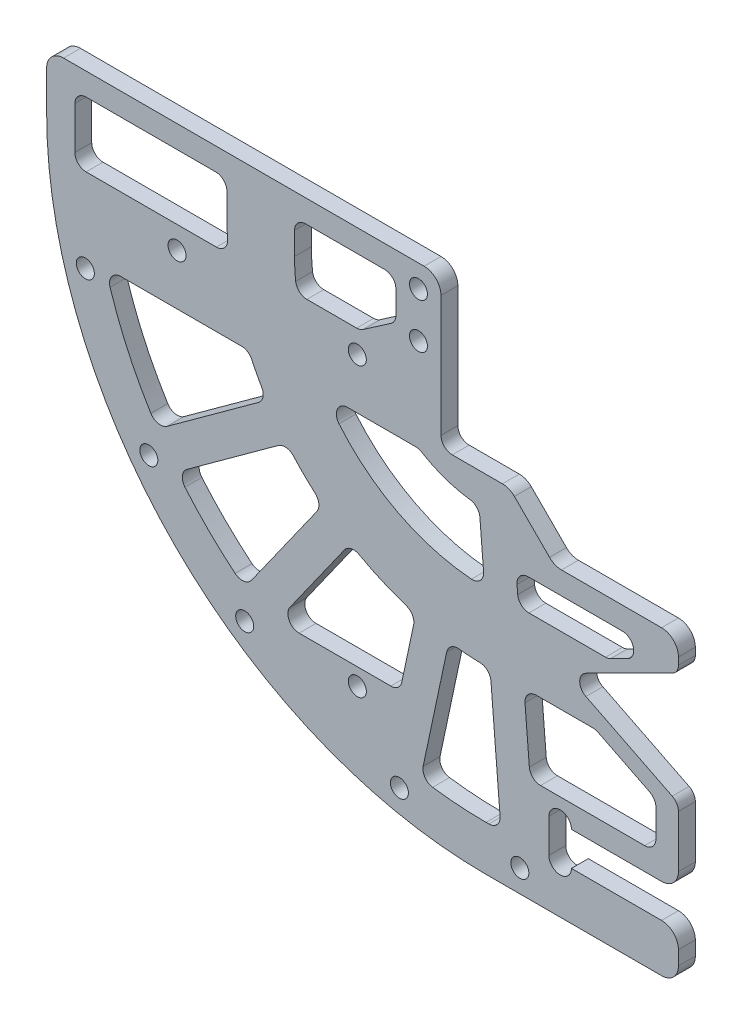
from build123d import *

# Parameters (mm, degrees)
EXTRUDE_1_DEPTH     = 3
SKETCH_3_R          = 1.6
CUT_EXTRUDE_1_DEPTH = 10
SKETCH_4_R          = 1.6
CUT_EXTRUDE_2_DEPTH = 10
SKETCH_5_R          = 2
CUT_EXTRUDE_3_DEPTH = 10
SKETCH_6_R          = 1.6
CUT_EXTRUDE_4_DEPTH = 3
SKETCH_7_R          = 1.6
CUT_EXTRUDE_5_DEPTH = 3
FILLET_1_R          = 2
CUT_EXTRUDE_6_DEPTH = 11.6
FILLET_2_R          = 3
CUT_EXTRUDE_7_DEPTH = 11.6
EXTRUDE_2_DEPTH     = 3
CUT_EXTRUDE_8_DEPTH = 193.98963408
FILLET_3_R          = 2
FILLET_4_R          = 2


with BuildPart() as part:
    # 草图2 → 凸台-拉伸1 (new body)
    with BuildSketch(Plane.XY):
        with BuildLine():
            Line((-177.154590294, 76.5), (-177.154590294, 66.5))
            ThreePointArc((-177.154590294, 66.5), (-154.308919227, 11.345671067), (-99.154590294, -11.5))
            Line((-99.154590294, -11.5), (-88, -11.5))
            Line((-88, -11.5), (-65, -11.5))
            Line((-65, -11.5), (-65, -3))
            Line((-65, -3), (-88, -3))
            Line((-88, -3), (-88, 3))
            Line((-88, 3), (-65, 3))
            Line((-65, 3), (-65, 17.056624327))
            Line((-65, 17.056624327), (-62.5, 18.5))
            Line((-62.5, 18.5), (-62.5, 34.5))
            Line((-62.5, 34.5), (-65, 35.943375673))
            Line((-65, 35.943375673), (-65, 50))
            Line((-65, 50), (-107.154590294, 50))
            Line((-107.154590294, 50), (-107.154590294, 76.5))
            Line((-107.154590294, 76.5), (-177.154590294, 76.5))
        make_face()
    extrude(amount=EXTRUDE_1_DEPTH)

    # 草图3 → 切除-拉伸1 (cut)
    with BuildSketch(Plane.XY.offset(3)):
        with Locations((-142, 6)):
            Circle(SKETCH_3_R)
        with Locations((-122, 6)):
            Circle(SKETCH_3_R)
    extrude(amount=-CUT_EXTRUDE_1_DEPTH, mode=Mode.SUBTRACT)

    # 草图4 → 切除-拉伸2 (cut)
    with BuildSketch(Plane.XY.offset(3)):
        with Locations((-170.287955794, 46.10283567)):
            Circle(SKETCH_4_R)
        with Locations((-159.021847878, 23.00389133)):
            Circle(SKETCH_4_R)
        with Locations((-114.540055415, -5.882922454)):
            Circle(SKETCH_4_R)
        with Locations((-93.154590294, -7.5)):
            Circle(SKETCH_4_R)
    extrude(amount=-CUT_EXTRUDE_2_DEPTH, mode=Mode.SUBTRACT)

    # 草图5 → 切除-拉伸3 (cut)
    with BuildSketch(Plane.XY.offset(3)):
        with Locations((-86, 3)):
            Circle(SKETCH_5_R)
        with Locations((-86, -3)):
            Circle(SKETCH_5_R)
    extrude(amount=-CUT_EXTRUDE_3_DEPTH, mode=Mode.SUBTRACT)

    # 草图6 → 切除-拉伸4 (cut)
    with BuildSketch(Plane.XY.offset(3)):
        with Locations((-111.154590294, 72.5)):
            Circle(SKETCH_6_R)
        with Locations((-111.154590294, 64.5)):
            Circle(SKETCH_6_R)
    extrude(amount=-CUT_EXTRUDE_4_DEPTH, mode=Mode.SUBTRACT)

    # 草图7 → 切除-拉伸5 (cut)
    with BuildSketch(Plane.XY.offset(3)):
        with Locations((-154.010091835, 57)):
            Circle(SKETCH_7_R)
        with Locations((-122.010091835, 57)):
            Circle(SKETCH_7_R)
    extrude(amount=-CUT_EXTRUDE_5_DEPTH, mode=Mode.SUBTRACT)

    # 圆角1
    fillet_1_edges = [part.edges().sort_by_distance(p)[0] for p in [
        (-107.154590294, 50, 1.5),
    ]]
    fillet(fillet_1_edges, radius=FILLET_1_R)

    # 草图8 → 切除-拉伸6 (cut)
    with BuildSketch(Plane.XY.offset(3)):
        Polygon((-95, 50), (-87, 42), (-65, 42), (-65, 50), align=None)
    extrude(amount=-CUT_EXTRUDE_6_DEPTH, mode=Mode.SUBTRACT)

    # 圆角2
    fillet_2_edges = [part.edges().sort_by_distance(p)[0] for p in [
        (-95, 50, 1.5),
        (-65, 42, 1.5),
        (-87, 42, 1.5),
        (-177.154590294, 76.5, 1.5),
        (-65, -11.5, 1.5),
        (-65, -3, 1.5),
        (-65, 3, 1.5),
        (-107.154590294, 76.5, 1.5),
    ]]
    fillet(fillet_2_edges, radius=FILLET_2_R)

    # 草图9 → 切除-拉伸7 (cut)
    with BuildSketch(Plane.XY.offset(3)):
        with BuildLine():
            ThreePointArc((-145.154590294, 66.5), (-145.072019197, 63.745054808), (-144.824602337, 61))
            Line((-144.824602337, 61), (-172.154590294, 61))
            Line((-172.154590294, 61), (-172.154590294, 72.5))
            Line((-172.154590294, 72.5), (-145.154590294, 72.5))
            Line((-145.154590294, 72.5), (-145.154590294, 66.5))
        make_face()
        with BuildLine():
            Line((-133.154590294, 72.5), (-133.154590294, 66.5))
            ThreePointArc((-133.154590294, 66.5), (-133.042454912, 63.740900214), (-132.706788434, 61))
            Line((-132.706788434, 61), (-121.498246805, 61))
            Line((-121.498246805, 61), (-115.154590294, 65.382793706))
            Line((-115.154590294, 65.382793706), (-115.154590294, 72.5))
            Line((-115.154590294, 72.5), (-133.154590294, 72.5))
        make_face()
        with BuildLine():
            Line((-127.680893946, 48), (-111.060471194, 48))
            ThreePointArc((-111.060471194, 48), (-105.946714568, 45.574727054), (-100.383436414, 44.53434642))
            Line((-100.383436414, 44.53434642), (-99.407755019, 32.500942548))
            ThreePointArc((-99.407755019, 32.500942548), (-115.498385615, 36.685903426), (-127.680893946, 48))
        make_face()
        with BuildLine():
            Line((-166.665700491, 48), (-141.270501777, 48))
            ThreePointArc((-141.270501777, 48), (-139.774924791, 44.913234948), (-138.053500491, 41.946491381))
            Line((-138.053500491, 41.946491381), (-157.497103519, 27.819886884))
            ThreePointArc((-157.497103519, 27.819886884), (-162.885217731, 37.544739224), (-166.665700491, 48))
        make_face()
        with BuildLine():
            ThreePointArc((-123.234931322, 27.306414096), (-117.609516434, 24.364317958), (-111.632610014, 22.224735756))
            Line((-111.632610014, 22.224735756), (-114.443614375, 9))
            Line((-114.443614375, 9), (-136.199324912, 9))
            Line((-136.199324912, 9), (-123.234931322, 27.306414096))
        make_face()
        with BuildLine():
            ThreePointArc((-105.763724409, 20.977265611), (-102.467762347, 20.619471549), (-99.154590294, 20.5))
            Line((-99.154590294, 20.5), (-98.434705623, 20.5))
            Line((-98.434705623, 20.5), (-96.488759677, -3.5))
            Line((-96.488759677, -3.5), (-99.154590294, -3.5))
            ThreePointArc((-99.154590294, -3.5), (-104.977776216, -3.257368827), (-110.760593955, -2.531157306))
            Line((-110.760593955, -2.531157306), (-105.763724409, 20.977265611))
        make_face()
        with BuildLine():
            ThreePointArc((-134.526788978, 37.092389415), (-131.483826087, 33.776606028), (-128.131412478, 30.774046183))
            Line((-128.131412478, 30.774046183), (-142.021368274, 11.160688967))
            ThreePointArc((-142.021368274, 11.160688967), (-148.351253457, 16.703530912), (-153.970392005, 22.965784918))
            Line((-153.970392005, 22.965784918), (-134.526788978, 37.092389415))
        make_face()
        Polygon((-69.56341496, 38), (-66.387988479, 32.5), (-93.387988479, 32.5), (-93.833934425, 38), align=None)
        Polygon((-91.320420912, 7), (-69, 7), (-69, 20.5), (-92.415015506, 20.5), align=None)
    extrude(amount=-CUT_EXTRUDE_7_DEPTH, mode=Mode.SUBTRACT)

    # 草图13 → 凸台-拉伸2 (add)
    with BuildSketch(Plane.XY.offset(3)):
        with BuildLine():
            Line((-74.049844719, 34.211145618), (-77.472135955, 32.5))
            Line((-77.472135955, 32.5), (-73, 32.5))
            Line((-73, 32.5), (-67.86914014, 35.06542993))
            Line((-67.86914014, 35.06542993), (-68.870939906, 36.800598024))
            Line((-68.870939906, 36.800598024), (-69.56341496, 38))
            Line((-69.56341496, 38), (-74.94427191, 38))
            ThreePointArc((-74.94427191, 38), (-72.997773931, 36.459505841), (-74.049844719, 34.211145618))
        make_face()
        Polygon((-79.708203932, 20.5), (-73, 20.5), (-69, 18.5), (-69, 15.145898034), align=None)
    extrude(amount=-EXTRUDE_2_DEPTH)

    # 草图11 → 切除-拉伸8 (cut, through all)
    with BuildSketch(Plane.XY.offset(3)):
        Polygon((-65, 36.5), (-85, 26.5), (-65, 16.5), (-59.800529593, 16.5), (-59.800529593, 36.5), align=None)
    extrude(amount=-CUT_EXTRUDE_8_DEPTH, mode=Mode.SUBTRACT)

    # 圆角3
    fillet_3_edges = [part.edges().sort_by_distance(p)[0] for p in [
        (-111.632610014, 22.224735756, 1.5),
        (-114.443614375, 9, 1.5),
        (-136.199324912, 9, 1.5),
        (-123.234931322, 27.306414096, 1.5),
        (-111.060471194, 48, 1.5),
        (-100.383436414, 44.53434642, 1.5),
        (-99.407755019, 32.500942548, 1.5),
        (-127.680893946, 48, 1.5),
        (-115.154590294, 72.5, 1.5),
        (-115.154590294, 65.382793706, 1.5),
        (-121.498246805, 61, 1.5),
        (-132.706788434, 61, 1.5),
        (-133.154590294, 72.5, 1.5),
        (-128.131412478, 30.774046183, 1.5),
        (-142.021368274, 11.160688967, 1.5),
        (-153.970392005, 22.965784918, 1.5),
        (-134.526788978, 37.092389415, 1.5),
        (-144.824602337, 61, 1.5),
        (-172.154590294, 61, 1.5),
        (-172.154590294, 72.5, 1.5),
        (-145.154590294, 72.5, 1.5),
        (-92.415015506, 20.5, 1.5),
        (-69, 15.145898034, 1.5),
        (-69, 7, 1.5),
        (-91.320420912, 7, 1.5),
        (-98.434705623, 20.5, 1.5),
        (-96.488759677, -3.5, 1.5),
        (-110.760593955, -2.531157306, 1.5),
        (-105.763724409, 20.977265611, 1.5),
        (-141.270501777, 48, 1.5),
        (-138.053500491, 41.946491381, 1.5),
        (-157.497103519, 27.819886884, 1.5),
        (-166.665700491, 48, 1.5),
        (-93.387988479, 32.5, 1.5),
        (-93.833934425, 38, 1.5),
        (-77.472135955, 32.5, 1.5),
        (-79.708203932, 20.5, 1.5),
    ]]
    fillet(fillet_3_edges, radius=FILLET_3_R)

    # 圆角4
    fillet_4_edges = [part.edges().sort_by_distance(p)[0] for p in [
        (-65, 16.5, 1.5),
        (-85, 26.5, 1.5),
        (-65, 36.5, 1.5),
    ]]
    fillet(fillet_4_edges, radius=FILLET_4_R)


solid = part.part
